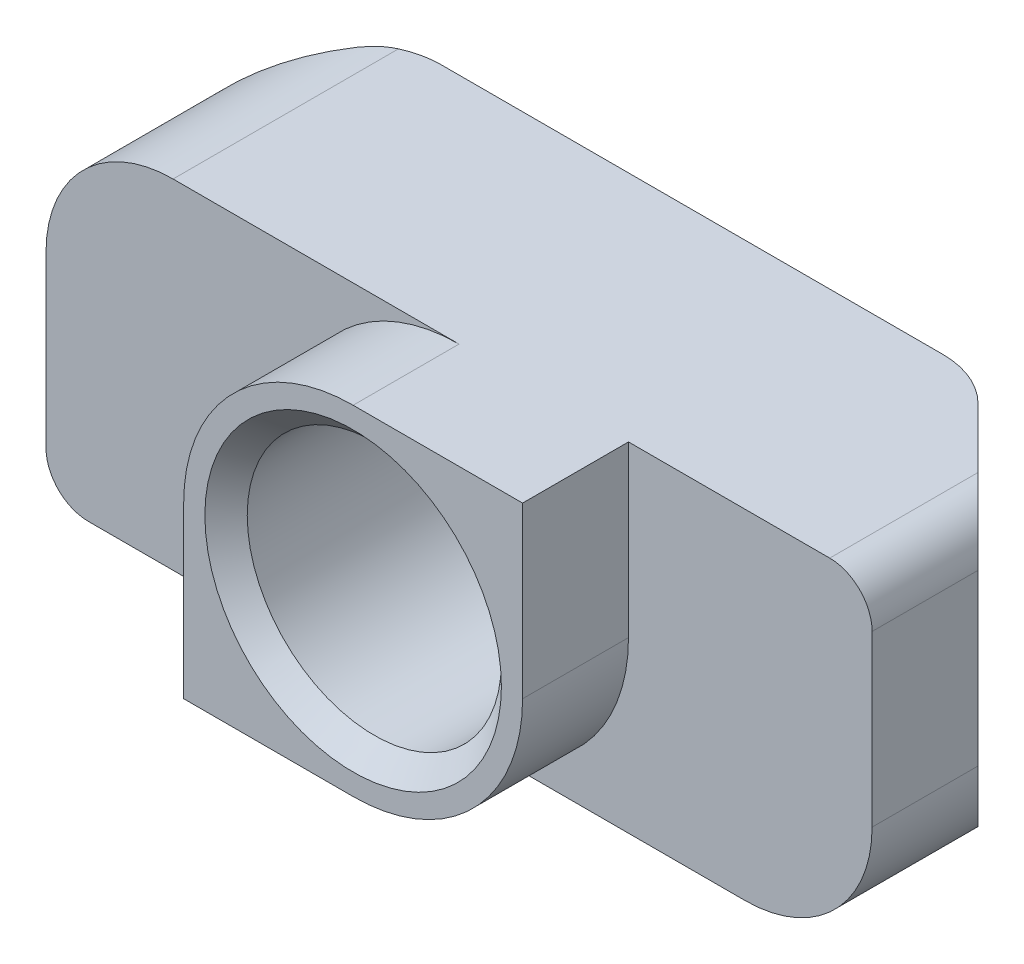
from build123d import *

# Parameters (mm, degrees)
EXTRUDE_1_DEPTH       = 8
SKETCH_2_W            = 5.75
SKETCH_2_H            = 2.5
CUT_EXTRUDE_1_DEPTH   = 15.935277031
SKETCH_3_W            = 5.75
SKETCH_3_H            = 2.5
CUT_EXTRUDE_2_DEPTH   = 15.935277031
HOLE_WIZARD_6_0_6_1_D = 6
CHAMFER_1_SIZE        = 0.5
FILLET_1_R            = 1
FILLET_2_R            = 2
FILLET_3_R            = 3
FILLET_4_R            = 4


with BuildPart() as part:
    # 草图1 → 凸台-拉伸1 (new body)
    with BuildSketch(Plane(origin=(0, 4, 0), x_dir=(1, 0, 0), z_dir=(0, 1, 0))):
        Polygon((-9.75, -3), (-9.75, -8), (9.75, -8), (9.75, -3), (6.75, 0), (-6.75, 0), align=None)
    extrude(amount=-EXTRUDE_1_DEPTH)

    # 草图2 → 切除-拉伸1 (cut, through all)
    with BuildSketch(Plane.XZ.offset(4)):
        with Locations((-6.875, 6.75)):
            Rectangle(SKETCH_2_W, SKETCH_2_H)
    extrude(amount=-CUT_EXTRUDE_1_DEPTH, mode=Mode.SUBTRACT)

    # 草图3 → 切除-拉伸2 (cut, through all)
    with BuildSketch(Plane.XZ.offset(4)):
        with Locations((6.875, 6.75)):
            Rectangle(SKETCH_3_W, SKETCH_3_H)
    extrude(amount=-CUT_EXTRUDE_2_DEPTH, mode=Mode.SUBTRACT)

    # Ø6.0 (6) 直径孔1 (through all)
    with Locations(Plane(origin=(0, 0, 0), x_dir=(-1, 0, 0), z_dir=(0, 0, -1))):
        with Locations((0, 0)):
            Hole(HOLE_WIZARD_6_0_6_1_D / 2)

    # 倒角1
    chamfer_1_edges = [part.edges().sort_by_distance(p)[0] for p in [
        (-3, 0, 0),
        (-3, 0, 8),
    ]]
    chamfer(chamfer_1_edges, length=CHAMFER_1_SIZE)

    # 圆角1
    fillet_1_edges = [part.edges().sort_by_distance(p)[0] for p in [
        (9.75, 4, 4.25),
        (-9.75, -4, 4.25),
    ]]
    fillet(fillet_1_edges, radius=FILLET_1_R)

    # 圆角2
    fillet_2_edges = [part.edges().sort_by_distance(p)[0] for p in [
        (-6.75, 0, 0),
        (6.75, 0, 0),
    ]]
    fillet(fillet_2_edges, radius=FILLET_2_R)

    # 圆角3
    fillet_3_edges = [part.edges().sort_by_distance(p)[0] for p in [
        (9.75, -4, 4.25),
        (-9.75, 4, 4.25),
    ]]
    fillet(fillet_3_edges, radius=FILLET_3_R)

    # 圆角4
    fillet_4_edges = [part.edges().sort_by_distance(p)[0] for p in [
        (-4, 4, 6.75),
        (4, -4, 6.75),
    ]]
    fillet(fillet_4_edges, radius=FILLET_4_R)


solid = part.part
